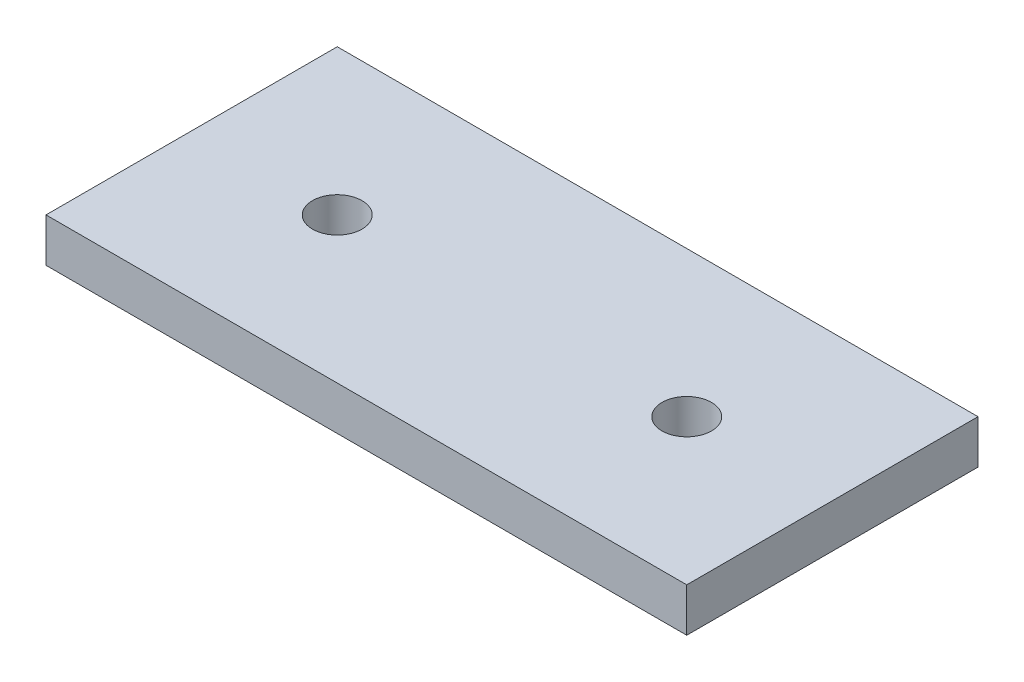
from build123d import *

# Parameters (mm, degrees)
SKETCH1_W             = 44
SKETCH1_H             = 20
JOINER_PLATE_DEPTH    = 3
BOLT_HOLES_DEPTH      = 25.351591324
BOLT_HOLES_DEPTH_BACK = 25.351591324
SKETCH2_R             = 1.7


with BuildPart() as part:
    # Sketch1 → Joiner Plate (new body)
    with BuildSketch(Plane(origin=(0, 0, 0), x_dir=(1, 0, 0), z_dir=(0, 1, 0))):
        Rectangle(SKETCH1_W, SKETCH1_H)
    extrude(amount=JOINER_PLATE_DEPTH)

    # Sketch2 → Bolt Holes (cut, two sides: drawn at the far end of the back side and taken through both)
    with BuildSketch(Plane(origin=(0, 0, 0), x_dir=(1, 0, 0), z_dir=(0, 1, 0)).offset(-BOLT_HOLES_DEPTH_BACK)):
        with Locations(Location((-12, 0, 0), (0, 0, 270))):
            Circle(SKETCH2_R)
        with Locations(Location((12, 0, 0), (0, 0, 270))):
            Circle(SKETCH2_R)
    extrude(amount=BOLT_HOLES_DEPTH + BOLT_HOLES_DEPTH_BACK, mode=Mode.SUBTRACT)


solid = part.part
